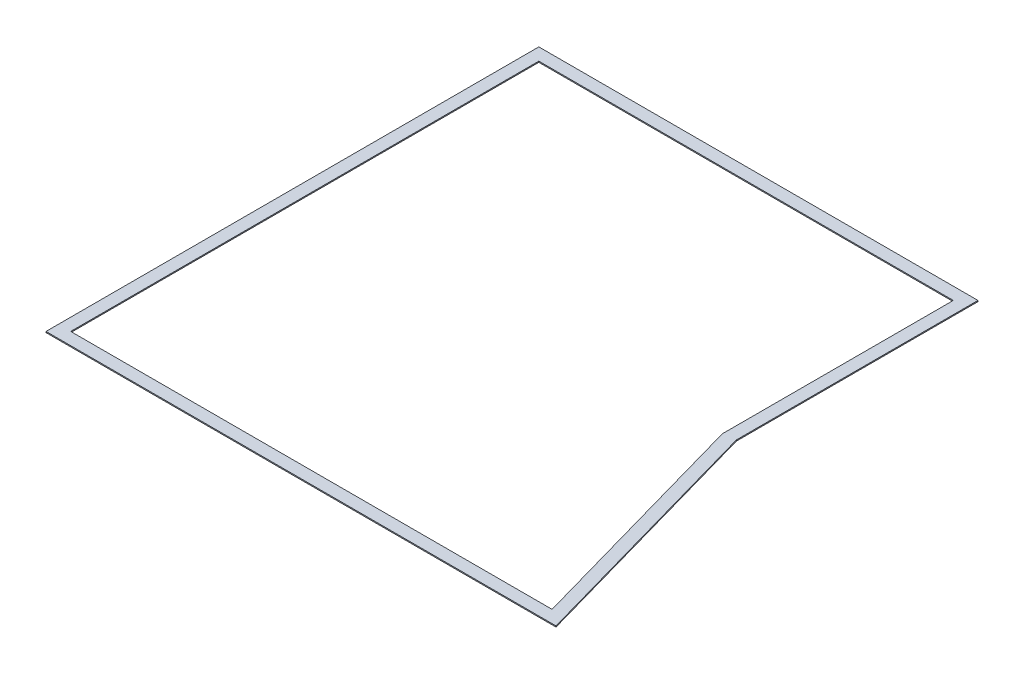
from build123d import *

# Parameters (mm, degrees)
EXTRUDE_1_DEPTH = 2


with BuildPart() as part:
    # 草图1 → 凸台-拉伸1 (new body)
    with BuildSketch(Plane(origin=(0, 0, 0), x_dir=(1, 0, 0), z_dir=(0, 1, 0))):
        Polygon((-409, 458), (-409, -460), (541, -460), (409, 8), (409, 458), align=None)
        Polygon((386, 435), (-386, 435), (-386, -437), (510.615467151, -437), (386, 4.818474445), align=None, mode=Mode.SUBTRACT)
    extrude(amount=EXTRUDE_1_DEPTH)


solid = part.part
